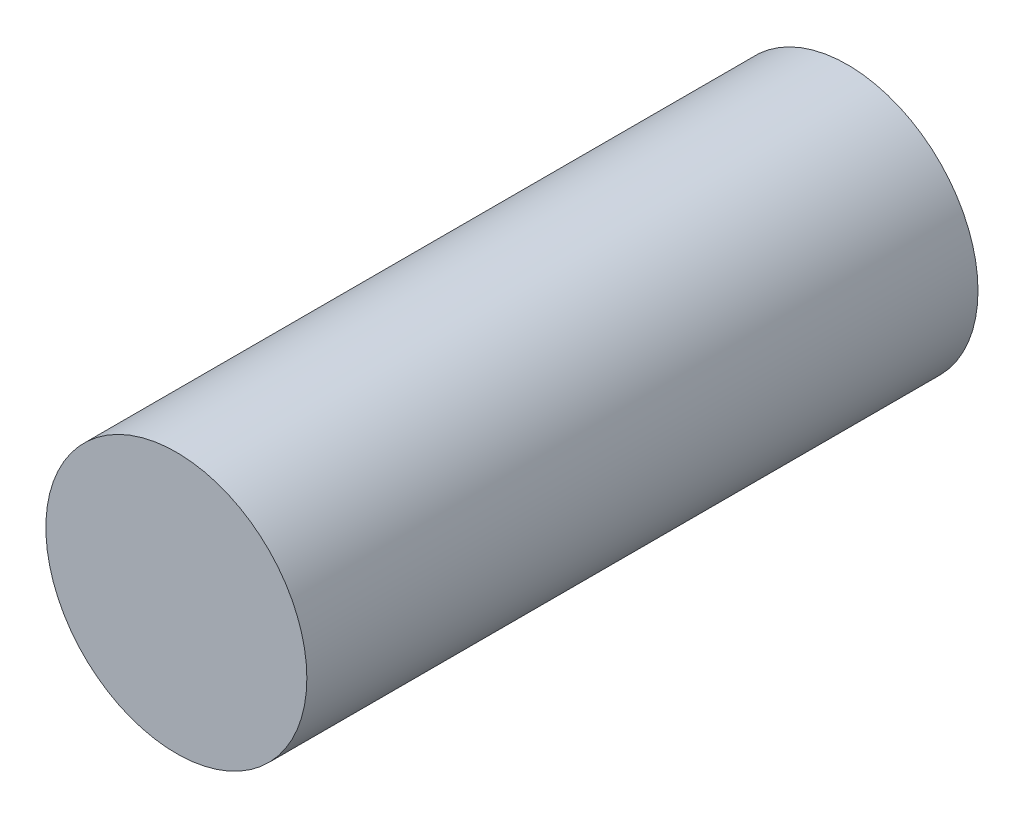
from build123d import *

# Parameters (mm, degrees)
SKETCH1_R           = 7
BOSS_EXTRUDE1_DEPTH = 36


with BuildPart() as part:
    # Sketch1 → Boss-Extrude1 (new body)
    with BuildSketch(Plane.XY):
        Circle(SKETCH1_R)
    extrude(amount=BOSS_EXTRUDE1_DEPTH)


solid = part.part
